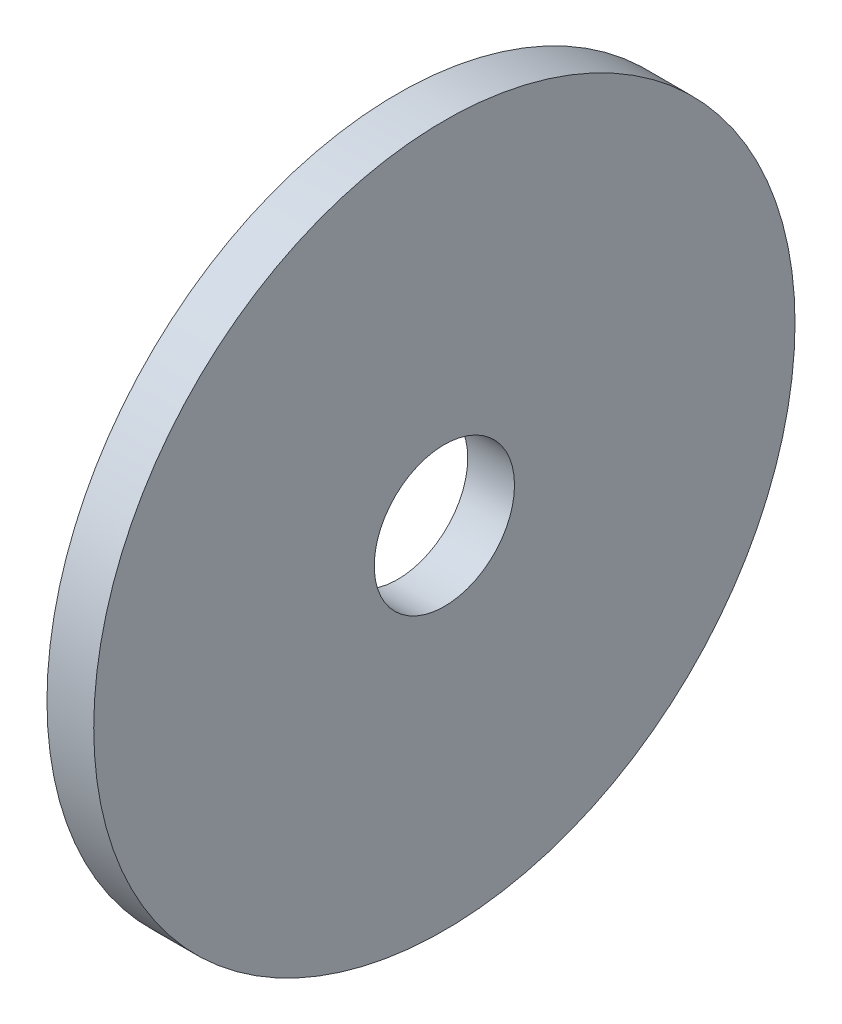
from build123d import *

# Parameters (mm, degrees)
SKETCH1_R           = 30
SKETCH1_R_2         = 6
BOSS_EXTRUDE1_DEPTH = 2


with BuildPart() as part:
    # Sketch1 → Boss-Extrude1 (new, symmetric)
    with BuildSketch(Plane(origin=(0, 0, 0), x_dir=(0, 0, -1), z_dir=(1, 0, 0))):
        Circle(SKETCH1_R)
        Circle(SKETCH1_R_2, mode=Mode.SUBTRACT)
    extrude(amount=BOSS_EXTRUDE1_DEPTH, both=True)


solid = part.part
